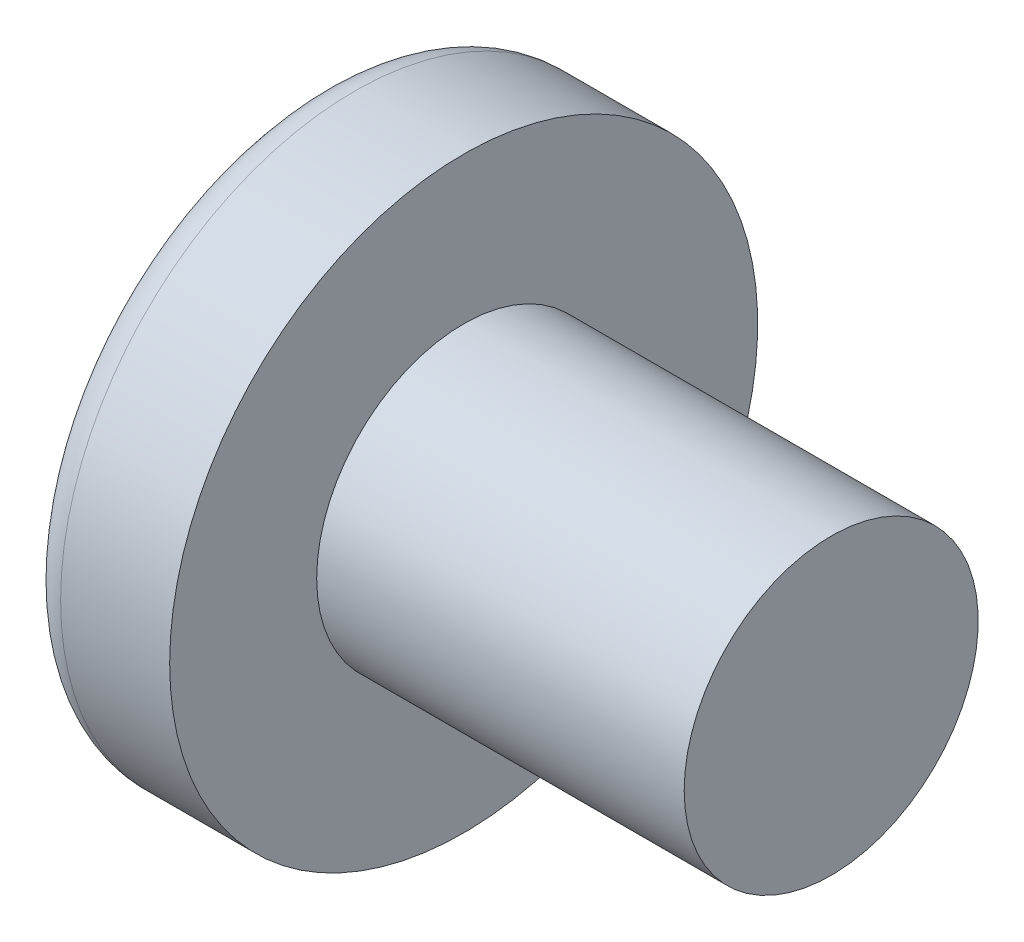
from build123d import *

# Parameters (mm, degrees)
CIRPATTERN1_COUNT = 2
CIRPATTERN1_ANGLE = 90


with BuildPart() as part:
    # BodySke → Base-Revolve (revolve)
    with BuildSketch(Plane.XY, mode=Mode.PRIVATE) as base_revolve_sk:
        with BuildLine():
            Line((3.1, 2), (3.1, 4))
            Line((3.1, 4), (1.616353821, 4))
            ThreePointArc((1.616353821, 4), (1.397629036, 3.947269784), (1.226960106, 3.800664452))
            ThreePointArc((1.226960106, 3.800664452), (0.314340807, 1.996902688), (0, 0))
            Line((0, 0), (8.1, 0))
            Line((8.1, 0), (8.1, 2))
            Line((8.1, 2), (3.1, 2))
        make_face()
    revolve(base_revolve_sk.sketch.rotate(Axis((-25.4, 0, 0), (1, 0, 0)), 90), axis=Axis((-25.4, 0, 0), (1, 0, 0)))

    # Sketch3 → Cut-Loft1 section 0
    with BuildSketch(Plane(origin=(0, 0, 0), x_dir=(0, 0, -1), z_dir=(1, 0, 0))):
        with BuildLine():
            Line((0.465, -2.2), (-0.465, -2.2))
            Line((-0.465, -2.2), (-0.465, 2.2))
            Line((-0.465, 2.2), (0.465, 2.2))
            Line((0.465, 2.2), (0.465, -2.2))
        make_face()
    # Sketch4 → Cut-Loft1 section 1
    with BuildSketch(Plane(origin=(2.45, 0, 0), x_dir=(0, 0, -1), z_dir=(1, 0, 0))):
        with BuildLine():
            Line((0.2325, -0.2325), (-0.2325, -0.2325))
            Line((-0.2325, -0.2325), (-0.2325, 0.2325))
            Line((-0.2325, 0.2325), (0.2325, 0.2325))
            Line((0.2325, 0.2325), (0.2325, -0.2325))
        make_face()
    cut_loft1 = loft(mode=Mode.SUBTRACT)

    # CirPattern1: Cut-Loft1 ×2 about axis
    cirpattern1_axis = Axis((0, 0, 0), (1, 0, 0))
    for i in range(1, CIRPATTERN1_COUNT):
        add(cut_loft1.rotate(cirpattern1_axis, i * CIRPATTERN1_ANGLE / (CIRPATTERN1_COUNT - 1)), mode=Mode.SUBTRACT)


solid = part.part
